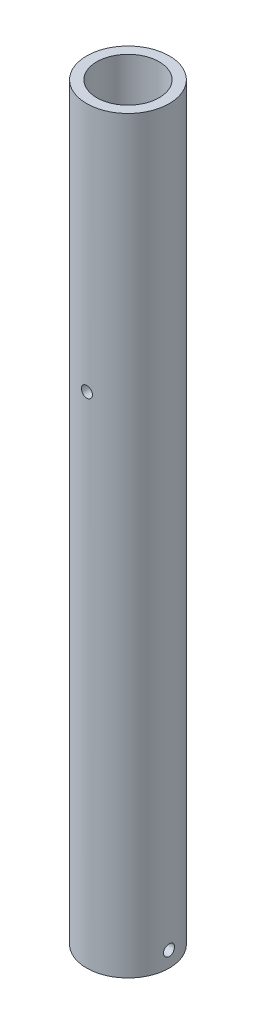
from build123d import *

# Parameters (mm, degrees)
SKETCH1_R               = 16.8275
SKETCH1_R_2             = 12.7
BOSS_EXTRUDE1_DEPTH     = 304.8
CUT_EXTRUDE1_DEPTH      = 306.727606723
CUT_EXTRUDE1_DEPTH_BACK = 306.727606723
SKETCH2_R               = 2.2479
CUT_EXTRUDE2_DEPTH      = 306.727606834
CUT_EXTRUDE2_DEPTH_BACK = 306.727606834
SKETCH3_R               = 2.2479


with BuildPart() as part:
    # Sketch1 → Boss-Extrude1 (new body)
    with BuildSketch(Plane(origin=(0, 0, 0), x_dir=(1, 0, 0), z_dir=(0, 1, 0))):
        with Locations(Location((0, 0, 0), (0, 0, 90))):
            Circle(SKETCH1_R)
        with Locations(Location((0, 0, 0), (0, 0, 90))):
            Circle(SKETCH1_R_2, mode=Mode.SUBTRACT)
    extrude(amount=BOSS_EXTRUDE1_DEPTH)

    # Sketch2 → Cut-Extrude1 (cut, two sides: drawn at the far end of the back side and taken through both)
    with BuildSketch(Plane.XY.offset(-CUT_EXTRUDE1_DEPTH_BACK)):
        with Locations((0, 203.2)):
            Circle(SKETCH2_R)
    extrude(amount=CUT_EXTRUDE1_DEPTH + CUT_EXTRUDE1_DEPTH_BACK, mode=Mode.SUBTRACT)

    # Sketch3 → Cut-Extrude2 (cut, two sides: drawn at the far end of the back side and taken through both)
    with BuildSketch(Plane(origin=(0, 0, 0), x_dir=(0, 0, -1), z_dir=(1, 0, 0)).offset(-CUT_EXTRUDE2_DEPTH_BACK)):
        with Locations((0, 6.35)):
            Circle(SKETCH3_R)
    extrude(amount=CUT_EXTRUDE2_DEPTH + CUT_EXTRUDE2_DEPTH_BACK, mode=Mode.SUBTRACT)


solid = part.part
